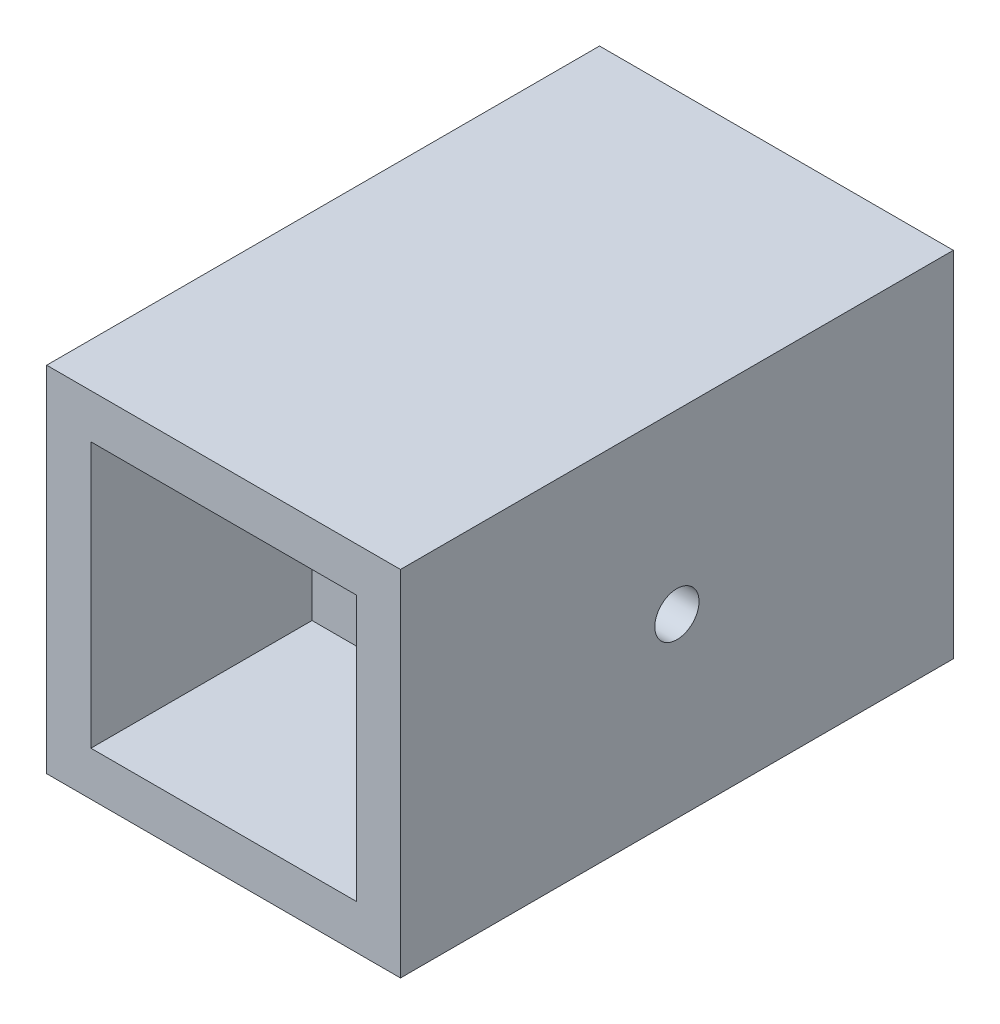
from build123d import *

# Parameters (mm, degrees)
SKETCH_1_W          = 16
SKETCH_1_H          = 16
EXTRUDE_2_DEPTH     = 25
SKETCH_2_W          = 12
SKETCH_2_H          = 12
CUT_EXTRUDE_1_DEPTH = 10
SKETCH_4_W          = 12
SKETCH_4_H          = 12
CUT_EXTRUDE_3_DEPTH = 10
SKETCH_5_R          = 1
CUT_EXTRUDE_4_DEPTH = 18


with BuildPart() as part:
    # 草图1 → 凸台-拉伸2 (new body)
    with BuildSketch(Plane.XY):
        with Locations((8, 8)):
            Rectangle(SKETCH_1_W, SKETCH_1_H)
    extrude(amount=EXTRUDE_2_DEPTH)

    # 草图2 → 切除-拉伸1 (cut)
    with BuildSketch(Plane(origin=(0, 0, 0), x_dir=(-1, 0, 0), z_dir=(0, 0, -1))):
        with Locations((-8, 8)):
            Rectangle(SKETCH_2_W, SKETCH_2_H)
    extrude(amount=-CUT_EXTRUDE_1_DEPTH, mode=Mode.SUBTRACT)

    # 草图4 → 切除-拉伸3 (cut)
    with BuildSketch(Plane.XY.offset(25)):
        with Locations((8, 8)):
            Rectangle(SKETCH_4_W, SKETCH_4_H)
    extrude(amount=-CUT_EXTRUDE_3_DEPTH, mode=Mode.SUBTRACT)

    # 草图5 → 切除-拉伸4 (cut)
    with BuildSketch(Plane(origin=(16, 0, 0), x_dir=(0, 0, -1), z_dir=(1, 0, 0))):
        with Locations((-12.5, 8)):
            Circle(SKETCH_5_R)
    extrude(amount=-CUT_EXTRUDE_4_DEPTH, mode=Mode.SUBTRACT)


solid = part.part
